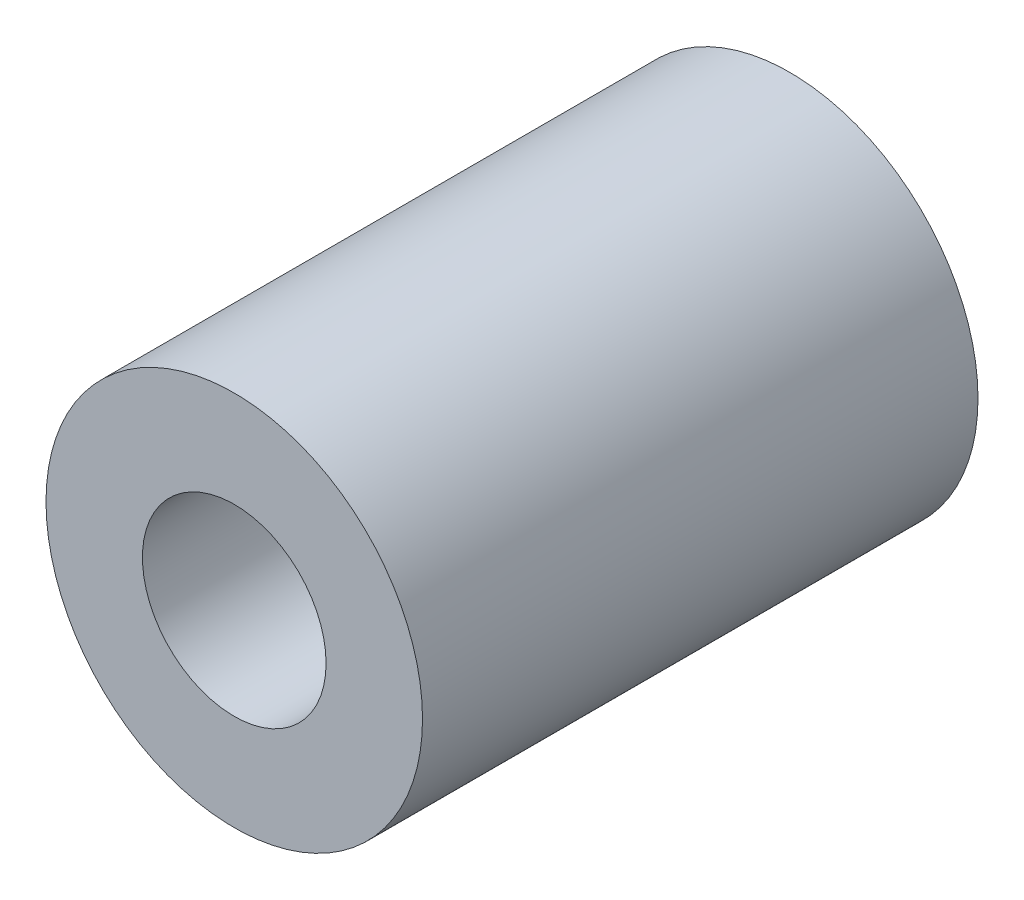
from build123d import *

# Parameters (mm, degrees)
SKETCH1_R           = 13.0175
SKETCH1_R_2         = 6.35
BOSS_EXTRUDE1_DEPTH = 38.40988


with BuildPart() as part:
    # Sketch1 → Boss-Extrude1 (new body)
    with BuildSketch(Plane.XY):
        Circle(SKETCH1_R)
        Circle(SKETCH1_R_2, mode=Mode.SUBTRACT)
    extrude(amount=BOSS_EXTRUDE1_DEPTH)


solid = part.part
